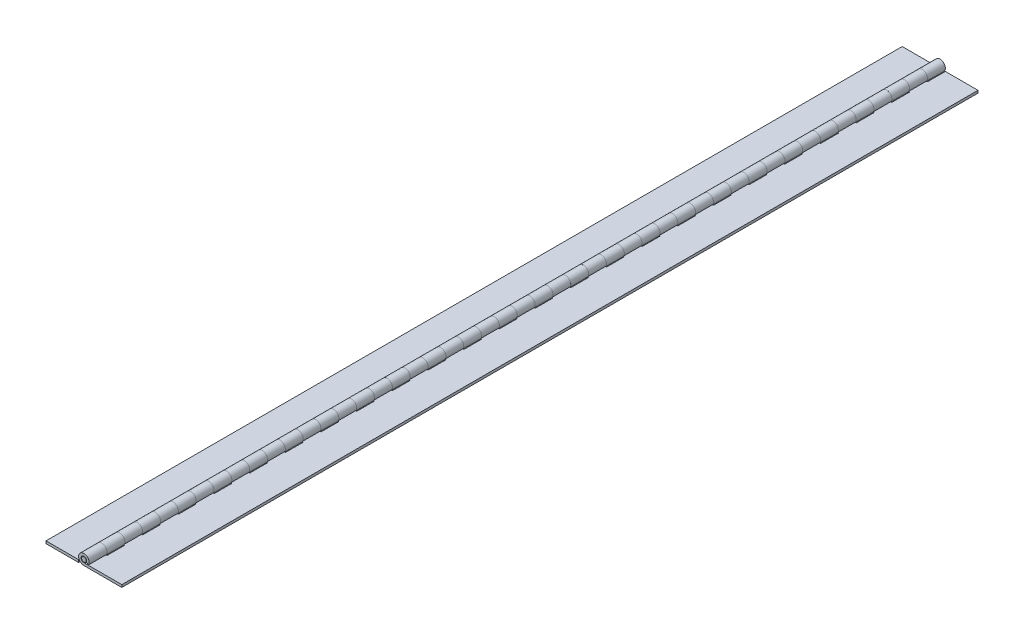
from build123d import *

# Parameters (mm, degrees)
EXTRUDE1_DEPTH     = 152.4
SKETCH3_W          = 3.76174
SKETCH3_H          = 6.35
CUT_EXTRUDE1_DEPTH = 25.4
LPATTERN1_COUNT    = 24
LPATTERN1_PITCH    = 12.7
EXTRUDE2_DEPTH     = 6.35
LPATTERN3_COUNT    = 24
LPATTERN3_PITCH    = 12.7
SKETCH6_W          = 11.58748
SKETCH6_H          = 0.889
EXTRUDE5_DEPTH     = 304.8
SKETCH7_R          = 0.9921875
EXTRUDE4_DEPTH     = 152.4
CHAMFER1_SIZE      = 0.1984375


with BuildPart() as part:
    # Sketch2 → Extrude1 (new, symmetric)
    with BuildSketch(Plane.XY):
        with BuildLine():
            Line((13.49375, -0.99187), (13.49375, -1.88087))
            Line((13.49375, -1.88087), (0, -1.88087))
            ThreePointArc((0, -1.88087), (-1.010590714, 1.586309669), (1.704647127, -0.79489001))
            Line((1.704647127, -0.79489001), (0.899227257, -0.419316557))
            ThreePointArc((0.899227257, -0.419316557), (-0.522474499, 0.843478769), (-0.025098571, -0.99187))
            Line((-0.025098571, -0.99187), (13.49375, -0.99187))
        make_face()
    extrude(amount=EXTRUDE1_DEPTH, both=True)

    # Sketch3 → Cut-Extrude1 (cut, symmetric)
    with BuildSketch(Plane(origin=(0, -0.99187, 0), x_dir=(1, 0, 0), z_dir=(0, 1, 0))):
        with Locations((0, 149.225)):
            Rectangle(SKETCH3_W, SKETCH3_H)
    cut_extrude1 = extrude(amount=CUT_EXTRUDE1_DEPTH, both=True, mode=Mode.SUBTRACT)

    # LPattern1: Cut-Extrude1 ×24
    with Locations(*[(0, 0, i * LPATTERN1_PITCH) for i in range(1, LPATTERN1_COUNT)]):
        add(cut_extrude1, mode=Mode.SUBTRACT)


with BuildPart() as body_2:
    # Sketch5 → Extrude2 (new body)
    with BuildSketch(Plane(origin=(0, 0, -152.4), x_dir=(-1, 0, 0), z_dir=(0, 0, -1))):
        with BuildLine():
            Line((0.025098571, -0.99187), (13.49375, -0.99187))
            Line((13.49375, -0.99187), (13.49375, -1.88087))
            Line((13.49375, -1.88087), (0, -1.88087))
            ThreePointArc((0, -1.88087), (-1.010590714, 1.586309669), (1.704647127, -0.79489001))
            Line((1.704647127, -0.79489001), (0.899227257, -0.419316557))
            ThreePointArc((0.899227257, -0.419316557), (-0.543644112, 0.829992238), (0.025098571, -0.99187))
        make_face()
    extrude(amount=-EXTRUDE2_DEPTH)


with BuildPart() as lpattern3_1:
    # LPattern3: pattern copy
    add(body_2.part.moved(Location(Vector(0, 0, 1) * (1 * LPATTERN3_PITCH))))


with BuildPart() as lpattern3_2:
    # LPattern3: pattern copy
    add(body_2.part.moved(Location(Vector(0, 0, 1) * (2 * LPATTERN3_PITCH))))


with BuildPart() as lpattern3_3:
    # LPattern3: pattern copy
    add(body_2.part.moved(Location(Vector(0, 0, 1) * (3 * LPATTERN3_PITCH))))


with BuildPart() as lpattern3_4:
    # LPattern3: pattern copy
    add(body_2.part.moved(Location(Vector(0, 0, 1) * (4 * LPATTERN3_PITCH))))


with BuildPart() as lpattern3_5:
    # LPattern3: pattern copy
    add(body_2.part.moved(Location(Vector(0, 0, 1) * (5 * LPATTERN3_PITCH))))


with BuildPart() as lpattern3_6:
    # LPattern3: pattern copy
    add(body_2.part.moved(Location(Vector(0, 0, 1) * (6 * LPATTERN3_PITCH))))


with BuildPart() as lpattern3_7:
    # LPattern3: pattern copy
    add(body_2.part.moved(Location(Vector(0, 0, 1) * (7 * LPATTERN3_PITCH))))


with BuildPart() as lpattern3_8:
    # LPattern3: pattern copy
    add(body_2.part.moved(Location(Vector(0, 0, 1) * (8 * LPATTERN3_PITCH))))


with BuildPart() as lpattern3_9:
    # LPattern3: pattern copy
    add(body_2.part.moved(Location(Vector(0, 0, 1) * (9 * LPATTERN3_PITCH))))


with BuildPart() as lpattern3_10:
    # LPattern3: pattern copy
    add(body_2.part.moved(Location(Vector(0, 0, 1) * (10 * LPATTERN3_PITCH))))


with BuildPart() as lpattern3_11:
    # LPattern3: pattern copy
    add(body_2.part.moved(Location(Vector(0, 0, 1) * (11 * LPATTERN3_PITCH))))


with BuildPart() as lpattern3_12:
    # LPattern3: pattern copy
    add(body_2.part.moved(Location(Vector(0, 0, 1) * (12 * LPATTERN3_PITCH))))


with BuildPart() as lpattern3_13:
    # LPattern3: pattern copy
    add(body_2.part.moved(Location(Vector(0, 0, 1) * (13 * LPATTERN3_PITCH))))


with BuildPart() as lpattern3_14:
    # LPattern3: pattern copy
    add(body_2.part.moved(Location(Vector(0, 0, 1) * (14 * LPATTERN3_PITCH))))


with BuildPart() as lpattern3_15:
    # LPattern3: pattern copy
    add(body_2.part.moved(Location(Vector(0, 0, 1) * (15 * LPATTERN3_PITCH))))


with BuildPart() as lpattern3_16:
    # LPattern3: pattern copy
    add(body_2.part.moved(Location(Vector(0, 0, 1) * (16 * LPATTERN3_PITCH))))


with BuildPart() as lpattern3_17:
    # LPattern3: pattern copy
    add(body_2.part.moved(Location(Vector(0, 0, 1) * (17 * LPATTERN3_PITCH))))


with BuildPart() as lpattern3_18:
    # LPattern3: pattern copy
    add(body_2.part.moved(Location(Vector(0, 0, 1) * (18 * LPATTERN3_PITCH))))


with BuildPart() as lpattern3_19:
    # LPattern3: pattern copy
    add(body_2.part.moved(Location(Vector(0, 0, 1) * (19 * LPATTERN3_PITCH))))


with BuildPart() as lpattern3_20:
    # LPattern3: pattern copy
    add(body_2.part.moved(Location(Vector(0, 0, 1) * (20 * LPATTERN3_PITCH))))


with BuildPart() as lpattern3_21:
    # LPattern3: pattern copy
    add(body_2.part.moved(Location(Vector(0, 0, 1) * (21 * LPATTERN3_PITCH))))


with BuildPart() as lpattern3_22:
    # LPattern3: pattern copy
    add(body_2.part.moved(Location(Vector(0, 0, 1) * (22 * LPATTERN3_PITCH))))


with BuildPart() as lpattern3_23:
    # LPattern3: pattern copy
    add(body_2.part.moved(Location(Vector(0, 0, 1) * (23 * LPATTERN3_PITCH))))


with BuildPart() as body_2_1:
    add(body_2.part)

    add(lpattern3_1.part)  # Extrude5 merges LPattern3_1

    add(lpattern3_2.part)  # Extrude5 merges LPattern3_2

    add(lpattern3_3.part)  # Extrude5 merges LPattern3_3

    add(lpattern3_4.part)  # Extrude5 merges LPattern3_4

    add(lpattern3_5.part)  # Extrude5 merges LPattern3_5

    add(lpattern3_6.part)  # Extrude5 merges LPattern3_6

    add(lpattern3_7.part)  # Extrude5 merges LPattern3_7

    add(lpattern3_8.part)  # Extrude5 merges LPattern3_8

    add(lpattern3_9.part)  # Extrude5 merges LPattern3_9

    add(lpattern3_10.part)  # Extrude5 merges LPattern3_10

    add(lpattern3_11.part)  # Extrude5 merges LPattern3_11

    add(lpattern3_12.part)  # Extrude5 merges LPattern3_12

    add(lpattern3_13.part)  # Extrude5 merges LPattern3_13

    add(lpattern3_14.part)  # Extrude5 merges LPattern3_14

    add(lpattern3_15.part)  # Extrude5 merges LPattern3_15

    add(lpattern3_16.part)  # Extrude5 merges LPattern3_16

    add(lpattern3_17.part)  # Extrude5 merges LPattern3_17

    add(lpattern3_18.part)  # Extrude5 merges LPattern3_18

    add(lpattern3_19.part)  # Extrude5 merges LPattern3_19

    add(lpattern3_20.part)  # Extrude5 merges LPattern3_20

    add(lpattern3_21.part)  # Extrude5 merges LPattern3_21

    add(lpattern3_22.part)  # Extrude5 merges LPattern3_22

    add(lpattern3_23.part)  # Extrude5 merges LPattern3_23
    # Sketch6 → Extrude5 (add)
    with BuildSketch(Plane(origin=(0, 0, -152.4), x_dir=(-1, 0, 0), z_dir=(0, 0, -1))):
        with Locations((7.70001, -1.43637)):
            Rectangle(SKETCH6_W, SKETCH6_H)
    extrude(amount=-EXTRUDE5_DEPTH)


with BuildPart() as body_3:
    # Sketch7 → Extrude4 (new, symmetric)
    with BuildSketch(Plane.XY):
        with Locations(Location((0, 0, 0), (0, 0, 180))):
            Circle(SKETCH7_R)
    extrude(amount=EXTRUDE4_DEPTH, both=True)

    # Chamfer1
    chamfer1_edges = [body_3.edges().sort_by_distance(p)[0] for p in [
        (0.9921875, 0, -152.4),
        (0.9921875, 0, 152.4),
    ]]
    chamfer(chamfer1_edges, length=CHAMFER1_SIZE)


solid = Compound([part.part, body_2_1.part, body_3.part])
